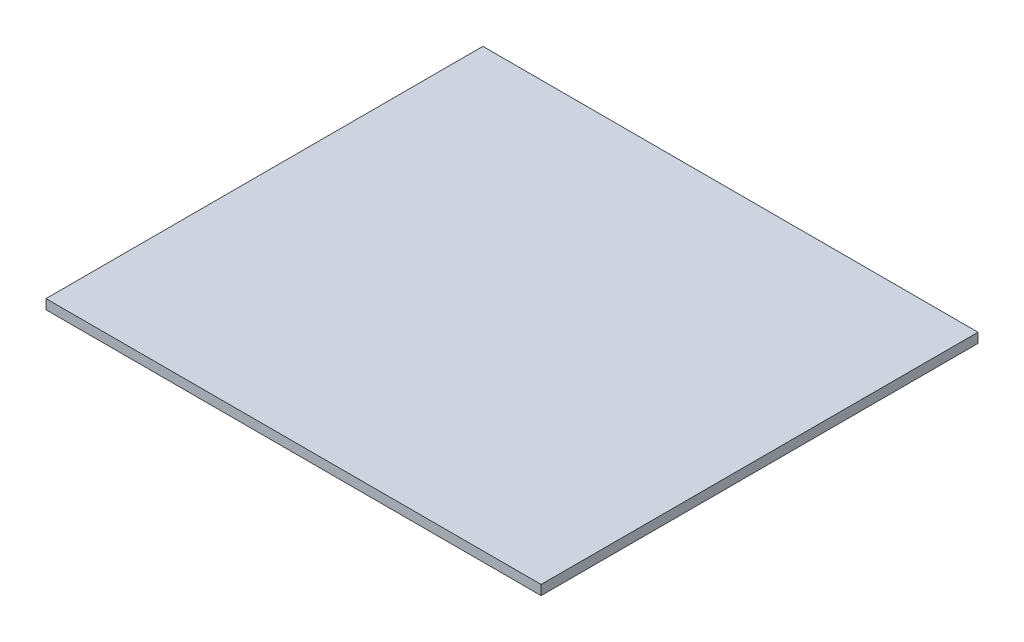
from build123d import *

# Parameters (mm, degrees)
SKETCH1_W           = 102
SKETCH1_H           = 90
BOSS_EXTRUDE1_DEPTH = 2


with BuildPart() as part:
    # Sketch1 → Boss-Extrude1 (new body)
    with BuildSketch(Plane(origin=(0, 0, 0), x_dir=(1, 0, 0), z_dir=(0, 1, 0))):
        Rectangle(SKETCH1_W, SKETCH1_H)
    extrude(amount=BOSS_EXTRUDE1_DEPTH)


solid = part.part
